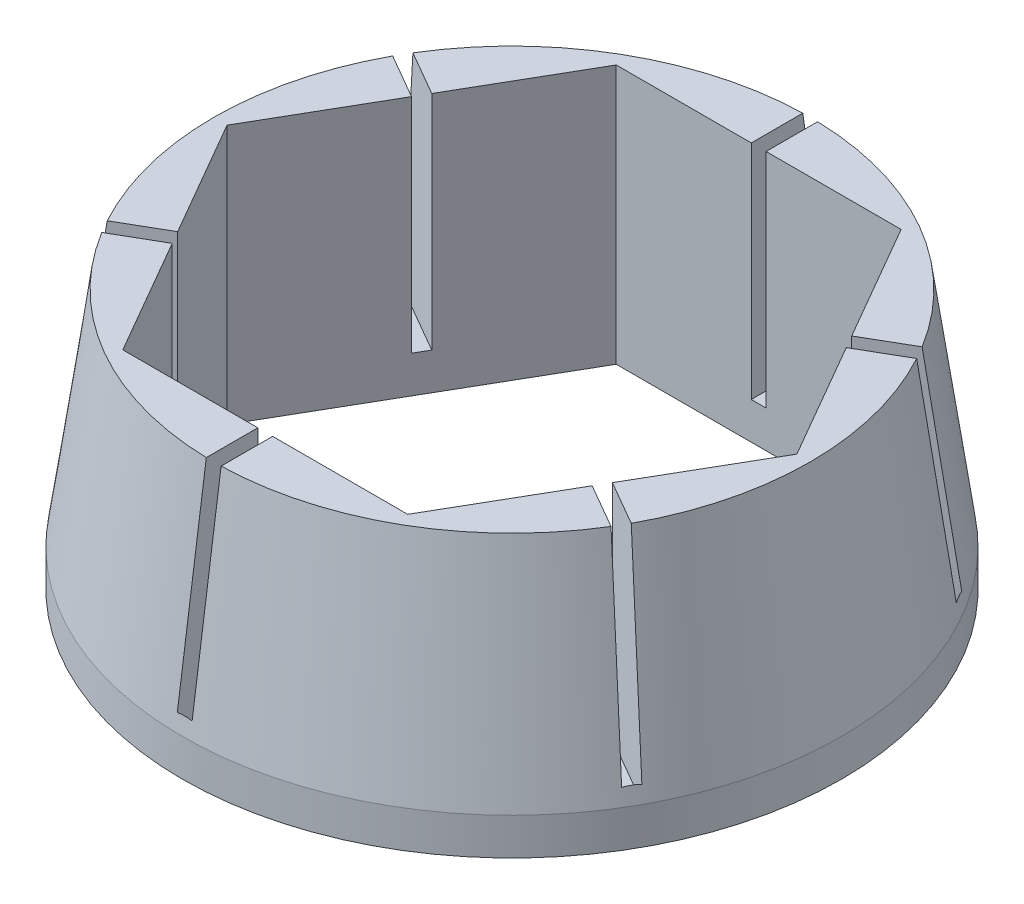
from build123d import *

# Parameters (mm, degrees)
J1_COLLET_HEX_BORE_DEPTH     = 29.804166365
J1_COLLET_MASTER_SLIT_DEPTH  = 12
J1_COLLET_SLIT_PATTERN_COUNT = 6


with BuildPart() as part:
    # J1_Collet_Outer_Profile → J1_Collet_Blank (revolve)
    with BuildSketch(Plane.XY):
        Polygon((16.113509984, 12), (0, 12), (0, -2), (17.8, -2), (17.8, 0), align=None)
    revolve(axis=Axis((0, 12, 0), (0, -1, 0)))

    # J1_Collet_Hex_Bore_Profile → J1_Collet_Hex_Bore (cut, through all)
    with BuildSketch(Plane.XZ.offset(2)):
        Polygon((15.386384674, 0), (7.693192337, 13.325), (-7.693192337, 13.325), (-15.386384674, 0), (-7.693192337, -13.325), (7.693192337, -13.325), align=None)
    extrude(amount=-J1_COLLET_HEX_BORE_DEPTH, mode=Mode.SUBTRACT)

    # J1_Collet_Master_Slit_Profile → J1_Collet_Master_Slit (cut)
    with BuildSketch(Plane(origin=(0, 12, 0), x_dir=(1, 0, 0), z_dir=(0, 1, 0))):
        Polygon((11.166583425, 6.908910162), (15.106160781, 9.183426209), (15.506160781, 8.490605886), (11.566583425, 6.216089838), align=None)
    j1_collet_master_slit = extrude(amount=-J1_COLLET_MASTER_SLIT_DEPTH, mode=Mode.SUBTRACT)

    # J1_Collet_Slit_Pattern: J1_Collet_Master_Slit ×6 about axis
    j1_collet_slit_pattern_axis = Axis((0, -21.828323373, 0), (0, 1, 0))
    for i in range(1, J1_COLLET_SLIT_PATTERN_COUNT):
        add(j1_collet_master_slit.rotate(j1_collet_slit_pattern_axis, i * 360 / J1_COLLET_SLIT_PATTERN_COUNT), mode=Mode.SUBTRACT)


solid = part.part
